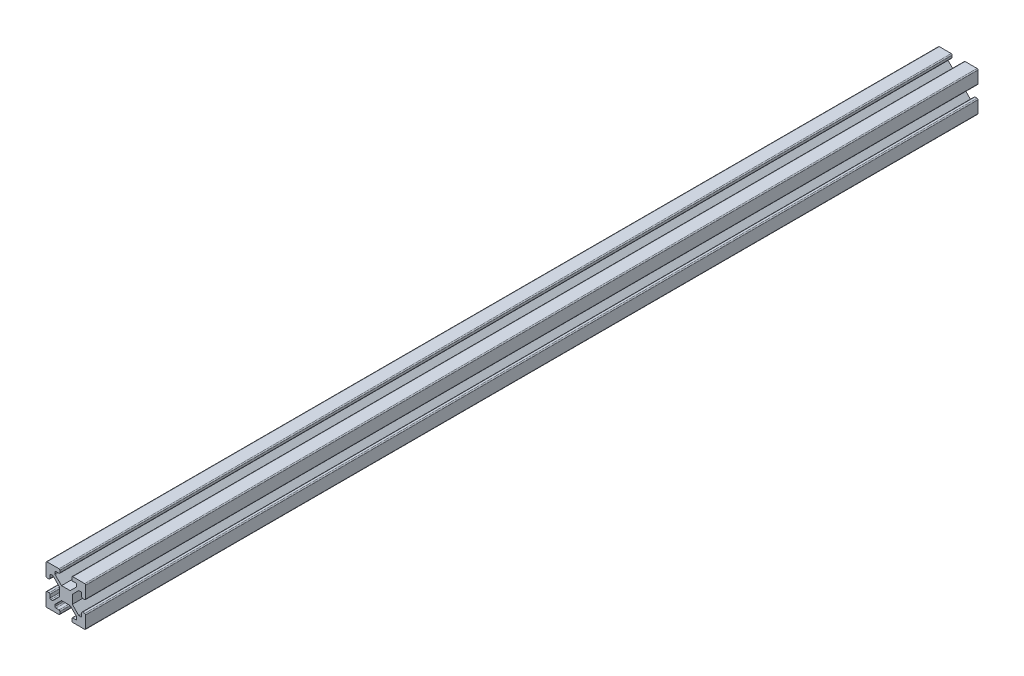
from build123d import *

# Parameters (mm, degrees)
EXTRUDE_1_DEPTH = 450


with BuildPart() as part:
    # 草图1 → 凸台-拉伸1 (new body)
    with BuildSketch(Plane.XY):
        with BuildLine():
            Line((6.5, 0), (0.5, 0))
            ThreePointArc((0.5, 0), (0.146446609, -0.146446609), (0, -0.5))
            Line((0, -0.5), (0, -6.5))
            ThreePointArc((0, -6.5), (0.146446609, -6.853553391), (0.5, -7))
            Line((0.5, -7), (1.5, -7))
            ThreePointArc((1.5, -7), (1.853553391, -6.853553391), (2, -6.5))
            Line((2, -6.5), (2, -5))
            ThreePointArc((2, -5), (2.146446609, -4.646446609), (2.5, -4.5))
            Line((2.5, -4.5), (3.220918534, -4.5))
            ThreePointArc((3.220918534, -4.5), (3.412260251, -4.538060234), (3.574471925, -4.646446609))
            Line((3.574471925, -4.646446609), (6.741642787, -7.813617472))
            Line((6.741642787, -7.813617472), (6.741642787, -12.186382528))
            Line((6.741642787, -12.186382528), (3.574471925, -15.353553391))
            ThreePointArc((3.574471925, -15.353553391), (3.412260251, -15.461939766), (3.220918534, -15.5))
            Line((3.220918534, -15.5), (2.5, -15.5))
            ThreePointArc((2.5, -15.5), (2.146446609, -15.353553391), (2, -15))
            Line((2, -15), (2, -13.5))
            ThreePointArc((2, -13.5), (1.853553391, -13.146446609), (1.5, -13))
            Line((1.5, -13), (0.5, -13))
            ThreePointArc((0.5, -13), (0.146446609, -13.146446609), (0, -13.5))
            Line((0, -13.5), (0, -19.5))
            ThreePointArc((0, -19.5), (0.146446609, -19.853553391), (0.5, -20))
            Line((0.5, -20), (6.5, -20))
            ThreePointArc((6.5, -20), (6.853553391, -19.853553391), (7, -19.5))
            Line((7, -19.5), (7, -18.5))
            ThreePointArc((7, -18.5), (6.853553391, -18.146446609), (6.5, -18))
            Line((6.5, -18), (5, -18))
            ThreePointArc((5, -18), (4.646446609, -17.853553391), (4.5, -17.5))
            Line((4.5, -17.5), (4.5, -16.779081466))
            ThreePointArc((4.5, -16.779081466), (4.538060234, -16.587739749), (4.646446609, -16.425528075))
            Line((4.646446609, -16.425528075), (7.667170862, -13.404803822))
            ThreePointArc((7.667170862, -13.404803822), (7.829382537, -13.296417446), (8.020724253, -13.258357213))
            Line((8.020724253, -13.258357213), (11.979275747, -13.258357213))
            ThreePointArc((11.979275747, -13.258357213), (12.170617463, -13.296417446), (12.332829138, -13.404803822))
            Line((12.332829138, -13.404803822), (15.353553391, -16.425528075))
            ThreePointArc((15.353553391, -16.425528075), (15.461939766, -16.587739749), (15.5, -16.779081466))
            Line((15.5, -16.779081466), (15.5, -17.5))
            ThreePointArc((15.5, -17.5), (15.353553391, -17.853553391), (15, -18))
            Line((15, -18), (13.5, -18))
            ThreePointArc((13.5, -18), (13.146446609, -18.146446609), (13, -18.5))
            Line((13, -18.5), (13, -19.5))
            ThreePointArc((13, -19.5), (13.146446609, -19.853553391), (13.5, -20))
            Line((13.5, -20), (19.5, -20))
            ThreePointArc((19.5, -20), (19.853553391, -19.853553391), (20, -19.5))
            Line((20, -19.5), (20, -13.5))
            ThreePointArc((20, -13.5), (19.853553391, -13.146446609), (19.5, -13))
            Line((19.5, -13), (18.5, -13))
            ThreePointArc((18.5, -13), (18.146446609, -13.146446609), (18, -13.5))
            Line((18, -13.5), (18, -15))
            ThreePointArc((18, -15), (17.853553391, -15.353553391), (17.5, -15.5))
            Line((17.5, -15.5), (16.779081466, -15.5))
            ThreePointArc((16.779081466, -15.5), (16.587739749, -15.461939766), (16.425528075, -15.353553391))
            Line((16.425528075, -15.353553391), (13.258357213, -12.186382528))
            Line((13.258357213, -12.186382528), (13.258357213, -7.813617472))
            Line((13.258357213, -7.813617472), (16.425528075, -4.646446609))
            ThreePointArc((16.425528075, -4.646446609), (16.587739749, -4.538060234), (16.779081466, -4.5))
            Line((16.779081466, -4.5), (17.5, -4.5))
            ThreePointArc((17.5, -4.5), (17.853553391, -4.646446609), (18, -5))
            Line((18, -5), (18, -6.5))
            ThreePointArc((18, -6.5), (18.146446609, -6.853553391), (18.5, -7))
            Line((18.5, -7), (19.5, -7))
            ThreePointArc((19.5, -7), (19.853553391, -6.853553391), (20, -6.5))
            Line((20, -6.5), (20, -0.5))
            ThreePointArc((20, -0.5), (19.853553391, -0.146446609), (19.5, 0))
            Line((19.5, 0), (13.5, 0))
            ThreePointArc((13.5, 0), (13.146446609, -0.146446609), (13, -0.5))
            Line((13, -0.5), (13, -1.5))
            ThreePointArc((13, -1.5), (13.146446609, -1.853553391), (13.5, -2))
            Line((13.5, -2), (15, -2))
            ThreePointArc((15, -2), (15.353553391, -2.146446609), (15.5, -2.5))
            Line((15.5, -2.5), (15.5, -3.220918534))
            ThreePointArc((15.5, -3.220918534), (15.461939766, -3.412260251), (15.353553391, -3.574471925))
            Line((15.353553391, -3.574471925), (12.186382528, -6.741642787))
            Line((12.186382528, -6.741642787), (7.813617472, -6.741642787))
            Line((7.813617472, -6.741642787), (4.646446609, -3.574471925))
            ThreePointArc((4.646446609, -3.574471925), (4.538060234, -3.412260251), (4.5, -3.220918534))
            Line((4.5, -3.220918534), (4.5, -2.5))
            ThreePointArc((4.5, -2.5), (4.646446609, -2.146446609), (5, -2))
            Line((5, -2), (6.5, -2))
            ThreePointArc((6.5, -2), (6.853553391, -1.853553391), (7, -1.5))
            Line((7, -1.5), (7, -0.5))
            ThreePointArc((7, -0.5), (6.853553391, -0.146446609), (6.5, 0))
        make_face()
    extrude(amount=EXTRUDE_1_DEPTH)


solid = part.part
